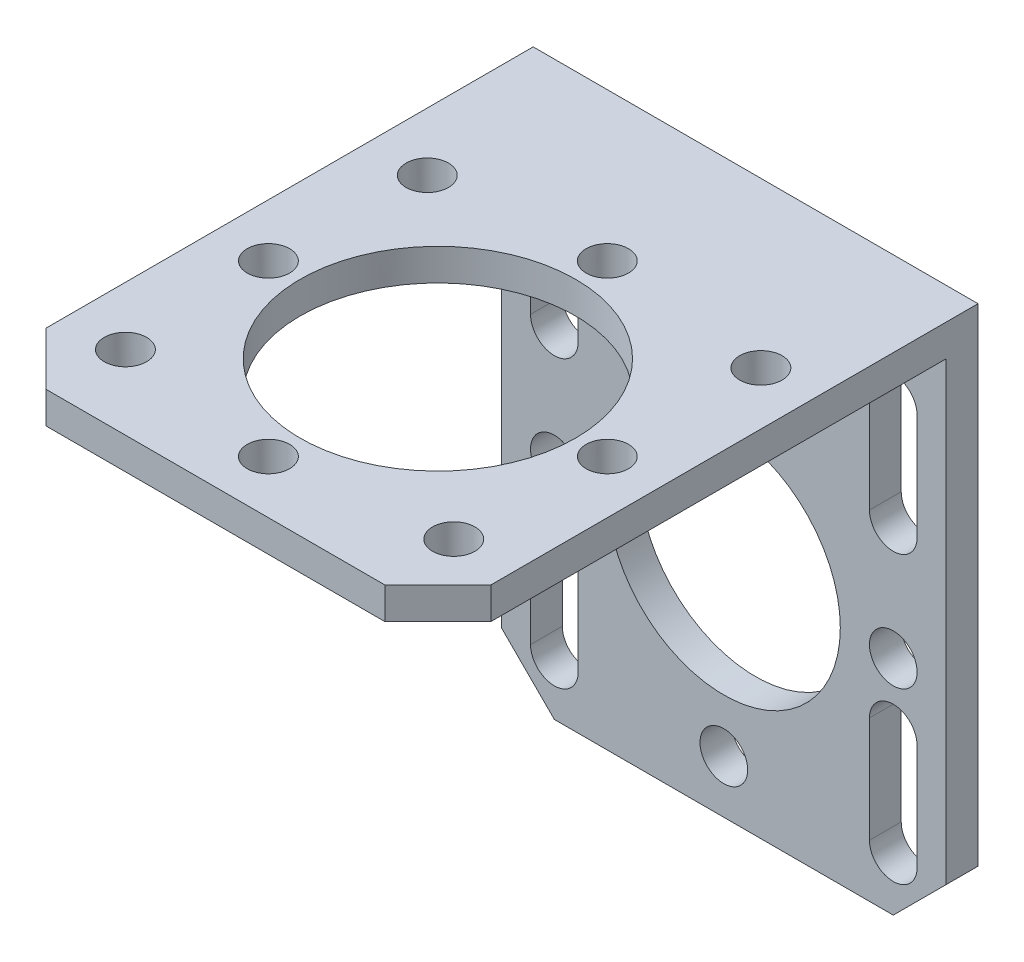
from build123d import *

# Parameters (mm, degrees)
SKETCH_1_W          = 42
SKETCH_1_H          = 51
EXTRUDE_1_DEPTH     = 3
SKETCH_2_W          = 42
SKETCH_2_H          = 3
EXTRUDE_2_DEPTH     = 48
CHAMFER_1_SIZE      = 5
SKETCH_3_R          = 13
SKETCH_3_R_2        = 2
CUT_EXTRUDE_1_DEPTH = 48
SKETCH_4_R          = 2.25
SKETCH_4_R_2        = 11
CUT_EXTRUDE_2_DEPTH = 48


with BuildPart() as part:
    # 스케치1 → 보스-돌출1 (new body)
    with BuildSketch(Plane.XY):
        Rectangle(SKETCH_1_W, SKETCH_1_H)
    extrude(amount=EXTRUDE_1_DEPTH)

    # 스케치2 → 보스-돌출2 (add)
    with BuildSketch(Plane.XY.offset(3)):
        with Locations((0, 24)):
            Rectangle(SKETCH_2_W, SKETCH_2_H)
    extrude(amount=EXTRUDE_2_DEPTH)

    # 모따기1
    chamfer_1_edges = [part.edges().sort_by_distance(p)[0] for p in [
        (-21, 24, 51),
        (21, 24, 51),
        (21, -25.5, 1.5),
        (-21, -25.5, 1.5),
    ]]
    chamfer(chamfer_1_edges, length=CHAMFER_1_SIZE)

    # 스케치3 → 컷-돌출1 (cut)
    with BuildSketch(Plane.XZ.offset(-22.5)):
        with Locations((0, 30)):
            Circle(SKETCH_3_R)
        with Locations((-15.5, 44)):
            Circle(SKETCH_3_R_2)
        with Locations((-15.5, 15.5)):
            Circle(SKETCH_3_R_2)
        with Locations((0, 46)):
            Circle(SKETCH_3_R_2)
        with Locations((15.5, 44)):
            Circle(SKETCH_3_R_2)
        with Locations((16, 30)):
            Circle(SKETCH_3_R_2)
        with Locations((0, 14)):
            Circle(SKETCH_3_R_2)
        with Locations((-16, 30)):
            Circle(SKETCH_3_R_2)
        with Locations((16, 15.5)):
            Circle(SKETCH_3_R_2)
    extrude(amount=-CUT_EXTRUDE_1_DEPTH, mode=Mode.SUBTRACT)

    # 스케치4 → 컷-돌출2 (cut)
    with BuildSketch(Plane.XY.offset(3)):
        with Locations((0, -20.5)):
            Circle(SKETCH_4_R)
        with Locations((0, -4.5)):
            Circle(SKETCH_4_R_2)
        with Locations((-16, -4.5)):
            Circle(SKETCH_4_R)
        with Locations((0, 11.5)):
            Circle(SKETCH_4_R)
        with Locations((16, -4.5)):
            Circle(SKETCH_4_R)
        with BuildLine():
            Line((-13.75, 16.5), (-13.75, 6.5))
            ThreePointArc((-13.75, 6.5), (-16, 4.25), (-18.25, 6.5))
            Line((-18.25, 6.5), (-18.25, 16.5))
            ThreePointArc((-18.25, 16.5), (-16, 18.75), (-13.75, 16.5))
        make_face()
        with BuildLine():
            Line((-13.75, -10.5), (-13.75, -20.5))
            ThreePointArc((-13.75, -20.5), (-16, -22.75), (-18.25, -20.5))
            Line((-18.25, -20.5), (-18.25, -10.5))
            ThreePointArc((-18.25, -10.5), (-16, -8.25), (-13.75, -10.5))
        make_face()
        with BuildLine():
            Line((13.75, -10.5), (13.75, -20.5))
            ThreePointArc((13.75, -20.5), (16, -22.75), (18.25, -20.5))
            Line((18.25, -20.5), (18.25, -10.5))
            ThreePointArc((18.25, -10.5), (16, -8.25), (13.75, -10.5))
        make_face()
        with BuildLine():
            Line((13.75, 16.5), (13.75, 6.5))
            ThreePointArc((13.75, 6.5), (16, 4.25), (18.25, 6.5))
            Line((18.25, 6.5), (18.25, 16.5))
            ThreePointArc((18.25, 16.5), (16, 18.75), (13.75, 16.5))
        make_face()
    extrude(amount=-CUT_EXTRUDE_2_DEPTH, mode=Mode.SUBTRACT)


solid = part.part
